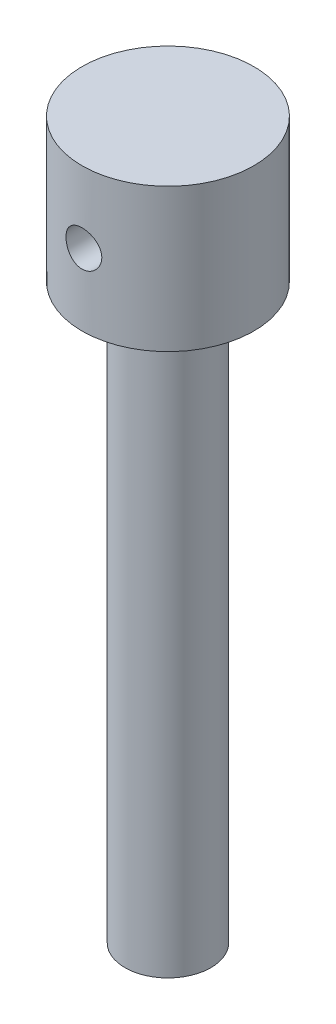
from build123d import *

# Parameters (mm, degrees)
SKETCH2_R               = 12
BOSS_EXTRUDE1_DEPTH     = 20
SKETCH3_R               = 6
BOSS_EXTRUDE2_DEPTH     = 80
CUT_EXTRUDE1_DEPTH      = 82.780193201
CUT_EXTRUDE1_DEPTH_BACK = 82.780193201
SKETCH4_R               = 2.5


with BuildPart() as part:
    # Sketch2 → Boss-Extrude1 (new body)
    with BuildSketch(Plane(origin=(0, 0, 0), x_dir=(1, 0, 0), z_dir=(0, 1, 0))):
        with Locations(Location((0, 0, 0), (0, 0, 270))):
            Circle(SKETCH2_R)
    extrude(amount=BOSS_EXTRUDE1_DEPTH)

    # Sketch3 → Boss-Extrude2 (add)
    with BuildSketch(Plane.XZ):
        with Locations(Location((0, 0, 0), (0, 0, 270))):
            Circle(SKETCH3_R)
    extrude(amount=BOSS_EXTRUDE2_DEPTH)

    # Sketch4 → Cut-Extrude1 (cut, two sides: drawn at the far end of the back side and taken through both)
    with BuildSketch(Plane.XY.offset(-CUT_EXTRUDE1_DEPTH_BACK)):
        with Locations(Location((0, 10, 0), (0, 0, 90.000000049))):
            Circle(SKETCH4_R)
    extrude(amount=CUT_EXTRUDE1_DEPTH + CUT_EXTRUDE1_DEPTH_BACK, mode=Mode.SUBTRACT)


solid = part.part
